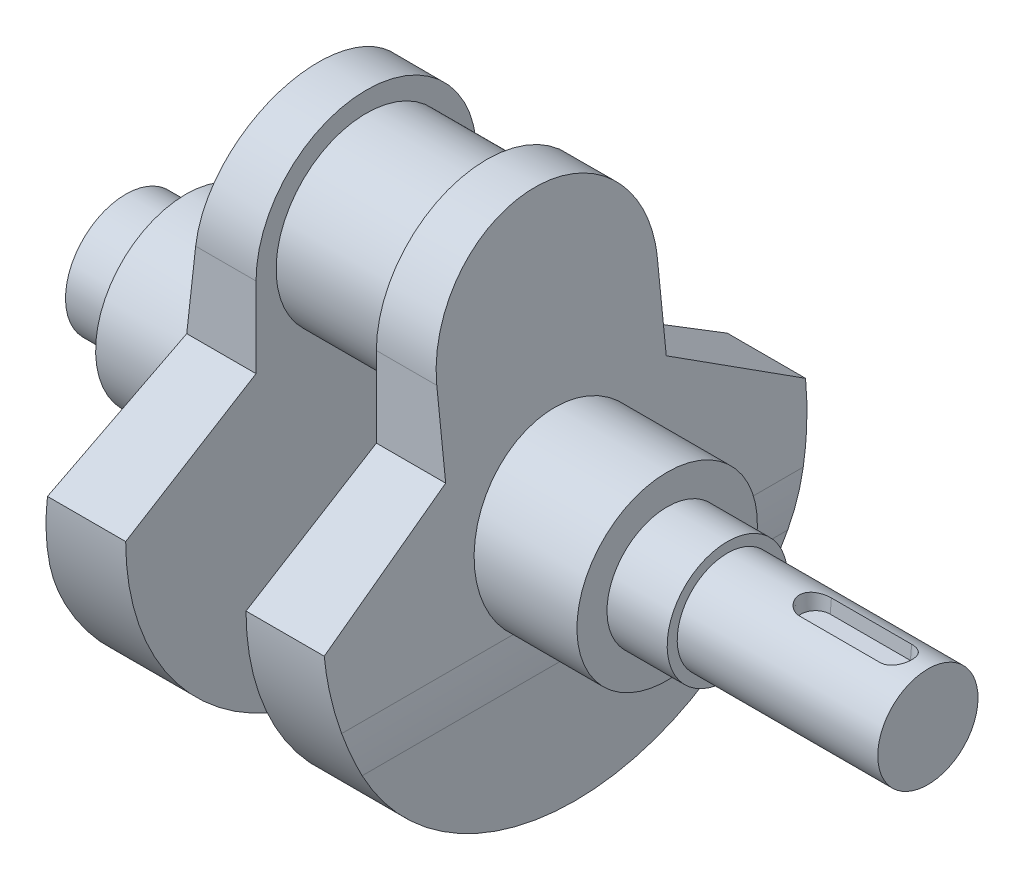
from build123d import *

# Parameters (mm, degrees)
SKETCH2_R                    = 22.5
BOSS_EXTRUDE1_DEPTH          = 15
BOSS_EXTRUDE2_DEPTH          = 22
CUT_EXTRUDE1_DEPTH           = 123.347864714
CUT_EXTRUDE1_DEPTH_BACK      = 123.347864714
FILLET1_R                    = 100
CUT_EXTRUDE2_START           = -27.5
CUT_EXTRUDE2_DEPTH           = 4
CUT_EXTRUDE2_TAPER           = 5
CUT_EXTRUDE2_OTHER_WAY_DEPTH = 171.953210066
CUT_EXTRUDE3_DEPTH           = 171.953210139
CUT_EXTRUDE3_DEPTH_BACK      = 171.953210139


with BuildPart() as part:
    # Sketch2 → Boss-Extrude1 (new body)
    with BuildSketch(Plane(origin=(0, 0, 0), x_dir=(0, 0, -1), z_dir=(1, 0, 0))):
        Circle(SKETCH2_R)
    extrude(amount=BOSS_EXTRUDE1_DEPTH)

    # Sketch3 → Boss-Extrude2 (add)
    with BuildSketch(Plane(origin=(15, 0, 0), x_dir=(0, 0, -1), z_dir=(1, 0, 0))):
        with BuildLine():
            Line((-27.5, 0), (-27.5, -20))
            Line((-27.5, -20), (-60, -40))
            ThreePointArc((-60, -40), (0, -100), (60, -40))
            Line((60, -40), (27.5, -20))
            Line((27.5, -20), (27.5, 0))
            ThreePointArc((27.5, 0), (0, 27.5), (-27.5, 0))
        make_face()
    extrude(amount=BOSS_EXTRUDE2_DEPTH)

    # Sketch6 → Cut-Extrude1 (cut, two sides: drawn at the far end of the back side and taken through both)
    with BuildSketch(Plane.XY.offset(-CUT_EXTRUDE1_DEPTH_BACK)):
        Polygon((37, 27.5), (27, 27.5), (37, -62.5), align=None)
    extrude(amount=CUT_EXTRUDE1_DEPTH + CUT_EXTRUDE1_DEPTH_BACK, mode=Mode.SUBTRACT)

    # Fillet1
    fillet1_edges = [part.edges().sort_by_distance(p)[0] for p in [
        (37, -62.5, 0),
    ]]
    fillet(fillet1_edges, radius=FILLET1_R)

    # Sketch8 → Revolve1 (revolve)
    with BuildSketch(Plane.XY):
        Polygon((32, -17.5), (60, -17.5), (60, -25), (75, -25), (75, -27.5), (125, -27.5), (125, -40), (32, -40), align=None)
    revolve(axis=Axis((125, -40, 0), (-1, 0, 0)))

    # Sketch9 → Cut-Extrude2 (cut)
    with BuildSketch(Plane(origin=(0, 0, 0), x_dir=(1, 0, 0), z_dir=(0, 1, 0)).offset(CUT_EXTRUDE2_START)):
        with BuildLine():
            ThreePointArc((117, -4), (121, 0), (117, 4))
            Line((117, 4), (97, 4))
            ThreePointArc((97, 4), (93, 0), (97, -4))
            Line((97, -4), (117, -4))
        make_face()
    extrude(amount=-CUT_EXTRUDE2_DEPTH, taper=CUT_EXTRUDE2_TAPER, mode=Mode.SUBTRACT)

    # Sketch9 → Cut-Extrude2 other way (cut)
    with BuildSketch(Plane(origin=(0, 0, 0), x_dir=(1, 0, 0), z_dir=(0, 1, 0)).offset(CUT_EXTRUDE2_START)):
        with BuildLine():
            ThreePointArc((117, -4), (121, 0), (117, 4))
            Line((117, 4), (97, 4))
            ThreePointArc((97, 4), (93, 0), (97, -4))
            Line((97, -4), (117, -4))
        make_face()
    extrude(amount=CUT_EXTRUDE2_OTHER_WAY_DEPTH, mode=Mode.SUBTRACT)

    # Mirror1: part across plane


with BuildPart() as part_1:
    add(part.part)
    add(part.part.mirror(Plane(origin=(0, 0, 0), x_dir=(0, 0, 1), z_dir=(1, 0, 0))))

    # Sketch10 → Cut-Extrude3 (cut, two sides: drawn at the far end of the back side and taken through both)
    with BuildSketch(Plane.XY.offset(-CUT_EXTRUDE3_DEPTH_BACK)):
        Polygon((-75, -536.475898777), (-75, -74.418396776), (-75, 5.304302941), (-75, 467.361804943), (-999.115004003, 467.361804943), (-999.115004003, -536.475898777), align=None)
    extrude(amount=CUT_EXTRUDE3_DEPTH + CUT_EXTRUDE3_DEPTH_BACK, mode=Mode.SUBTRACT)


solid = part_1.part
